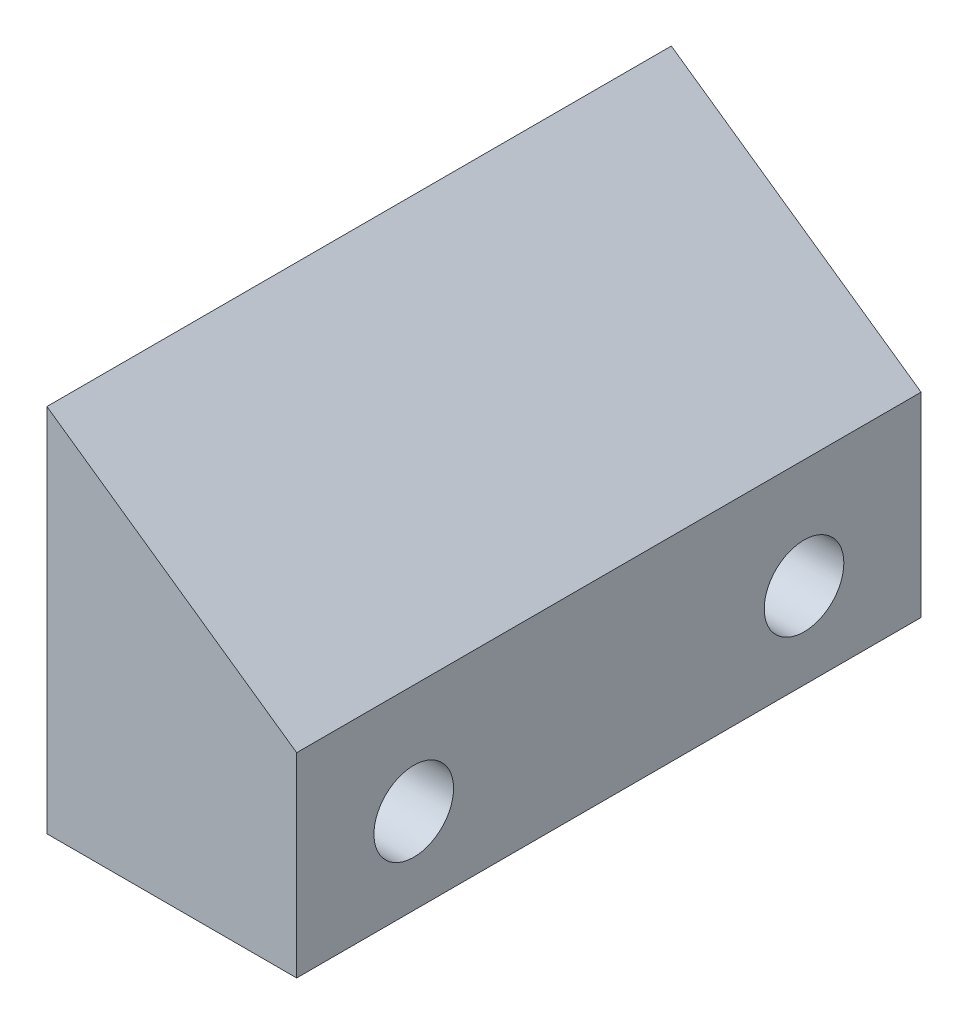
from build123d import *

# Parameters (mm, degrees)
EXTRUDE_1_DEPTH     = 40
HOLE_WIZARD_M12_1_D = 10.2


with BuildPart() as part:
    # 草图1 → 凸台-拉伸1 (new, symmetric)
    with BuildSketch(Plane.XY):
        Polygon((0, 0), (0, 47.406641223), (32, 25), (32, 0), align=None)
    extrude(amount=EXTRUDE_1_DEPTH, both=True)

    # M12 螺纹孔1 (through all)
    with Locations(Plane(origin=(32, 0, 0), x_dir=(0, 0, -1), z_dir=(1, 0, 0))):
        with Locations((-25, 11), (25, 11)):
            Hole(HOLE_WIZARD_M12_1_D / 2)


solid = part.part
